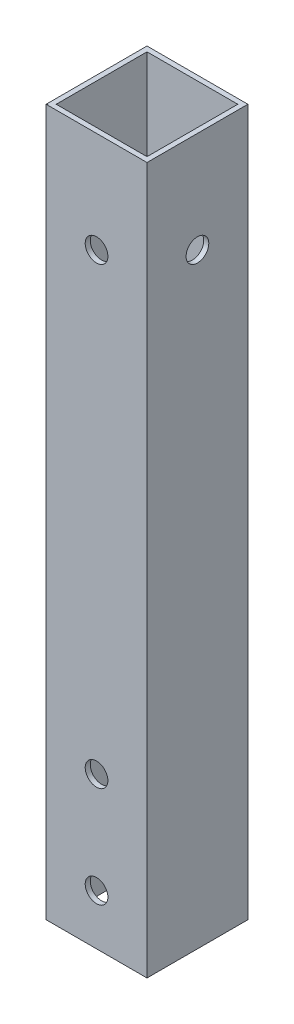
from build123d import *

# Parameters (mm, degrees)
SKETCH1_W           = 20
SKETCH1_H           = 20
SKETCH1_W_2         = 18
SKETCH1_H_2         = 18
BOSS_EXTRUDE1_DEPTH = 140
SKETCH2_R           = 2.25
CUT_EXTRUDE1_DEPTH  = 142.774468788
SKETCH3_R           = 2.25
CUT_EXTRUDE2_DEPTH  = 142.774468788


with BuildPart() as part:
    # Sketch1 → Boss-Extrude1 (new body)
    with BuildSketch(Plane(origin=(0, 0, 0), x_dir=(1, 0, 0), z_dir=(0, 1, 0))):
        Rectangle(SKETCH1_W, SKETCH1_H)
        Rectangle(SKETCH1_W_2, SKETCH1_H_2, mode=Mode.SUBTRACT)
    extrude(amount=BOSS_EXTRUDE1_DEPTH)

    # Sketch2 → Cut-Extrude1 (cut, through all)
    with BuildSketch(Plane.XY.offset(10)):
        with Locations((0, 10)):
            Circle(SKETCH2_R)
        with Locations((0, 30)):
            Circle(SKETCH2_R)
        with Locations((0, 120)):
            Circle(SKETCH2_R)
    extrude(amount=-CUT_EXTRUDE1_DEPTH, mode=Mode.SUBTRACT)

    # Sketch3 → Cut-Extrude2 (cut, through all)
    with BuildSketch(Plane(origin=(10, 0, 0), x_dir=(0, 0, -1), z_dir=(1, 0, 0))):
        with Locations((0, 120)):
            Circle(SKETCH3_R)
    extrude(amount=-CUT_EXTRUDE2_DEPTH, mode=Mode.SUBTRACT)


solid = part.part
